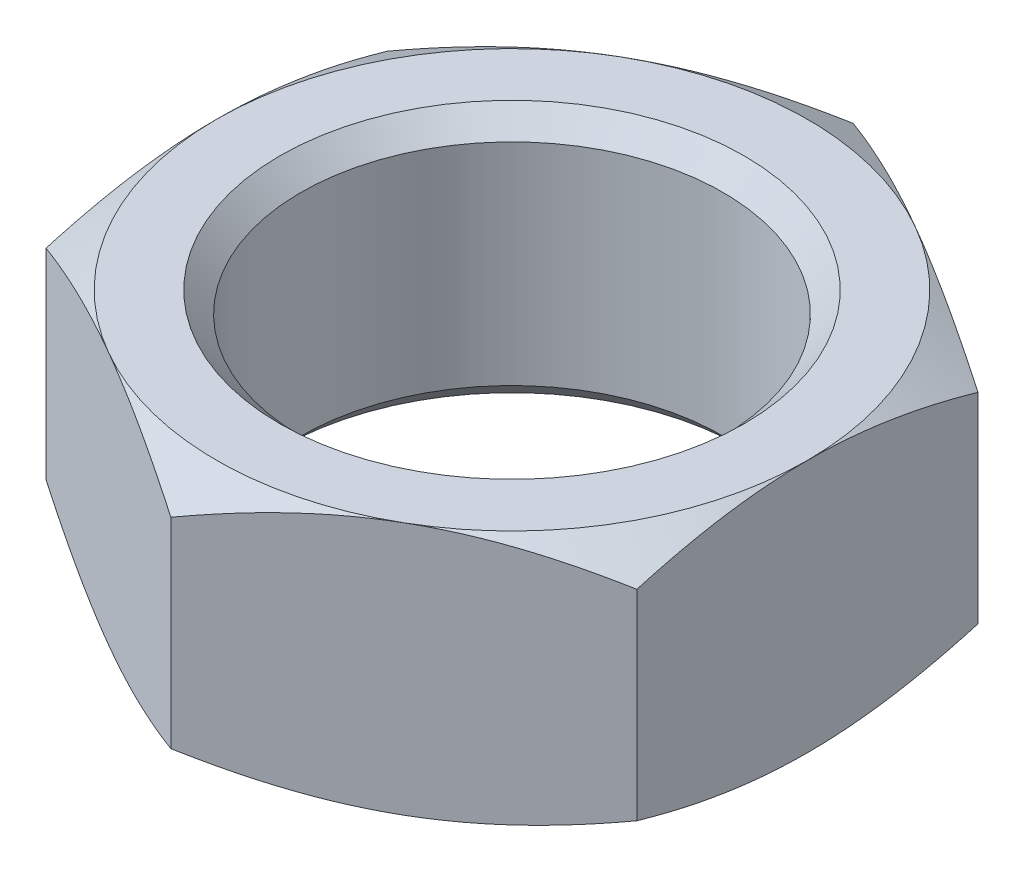
from build123d import *

# Parameters (mm, degrees)
BOSS_EXTRUDE1_DEPTH     = 6
SKETCH3_OUTSIDE_W       = 80.454
SKETCH3_OUTSIDE_H       = 84.786
SKETCH3_OUTSIDE_R       = 14
CUT_EXTRUDE1_DEPTH      = 12
CUT_EXTRUDE1_DRAFT      = -60
MIRROR1_COPY_1_SKETCH_W = 80.454
MIRROR1_COPY_1_SKETCH_H = 84.786
MIRROR1_COPY_1_SKETCH_R = 14
MIRROR1_COPY_1_DEPTH    = 12
MIRROR1_COPY_1_DRAFT    = -60
SKETCH4_R               = 10
CUT_EXTRUDE2_DEPTH      = 25.522098877
CHAMFER1_SIZE           = 1


with BuildPart() as part:
    # Sketch2 → Boss-Extrude1 (new, symmetric)
    with BuildSketch(Plane(origin=(0, 0, 0), x_dir=(1, 0, 0), z_dir=(0, 1, 0))):
        Polygon((0, 16.165807537), (-14, 8.082903769), (-14, -8.082903769), (0, -16.165807537), (14, -8.082903769), (14, 8.082903769), align=None)
    extrude(amount=BOSS_EXTRUDE1_DEPTH, both=True)


with BuildPart() as cut_extrude1_tool:
    # Sketch3 outside → Cut-Extrude1 (with draft: the straight prism first)
    with BuildSketch(Plane(origin=(0, 6, 0), x_dir=(1, 0, 0), z_dir=(0, 1, 0))):
        Rectangle(SKETCH3_OUTSIDE_W, SKETCH3_OUTSIDE_H)
        Circle(SKETCH3_OUTSIDE_R, mode=Mode.SUBTRACT)
    extrude(amount=-CUT_EXTRUDE1_DEPTH)
    # Cut-Extrude1: the draft: its side faces are tilted about the plane it starts from
    cut_extrude1_sides = [cut_extrude1_tool.faces().sort_by_distance(p)[0] for p in [
        (0, 0, 42.393),
        (40.227, 0, 0),
        (0, 0, -42.393),
        (-40.227, 0, 0),
        (-14, 0, 0),
    ]]
    draft(cut_extrude1_sides, Plane(origin=(0, 6, 0), x_dir=(1, 0, 0), z_dir=(0, 1, 0)), CUT_EXTRUDE1_DRAFT)


with BuildPart() as part_1:
    add(part.part)

    # Cut-Extrude1: cut by cut_extrude1_tool
    add(cut_extrude1_tool.part, mode=Mode.SUBTRACT)


with BuildPart() as mirror1_copy_1_tool:
    # Mirror1 copy 1 sketch → Mirror1 copy 1 (with draft: the straight prism first)
    with BuildSketch(Plane.XZ.offset(6)):
        Rectangle(MIRROR1_COPY_1_SKETCH_W, MIRROR1_COPY_1_SKETCH_H)
        Circle(MIRROR1_COPY_1_SKETCH_R, mode=Mode.SUBTRACT)
    extrude(amount=-MIRROR1_COPY_1_DEPTH)
    # Mirror1 copy 1: the draft: its side faces are tilted about the plane it starts from
    mirror1_copy_1_sides = [mirror1_copy_1_tool.faces().sort_by_distance(p)[0] for p in [
        (0, 0, 42.393),
        (40.227, 0, 0),
        (0, 0, -42.393),
        (-40.227, 0, 0),
        (-14, 0, 0),
    ]]
    draft(mirror1_copy_1_sides, Plane.XZ.offset(6), MIRROR1_COPY_1_DRAFT)


with BuildPart() as part_2:
    add(part_1.part)

    # Mirror1 copy 1: cut by mirror1_copy_1_tool
    add(mirror1_copy_1_tool.part, mode=Mode.SUBTRACT)

    # Sketch4 → Cut-Extrude2 (cut, through all)
    with BuildSketch(Plane.XZ.offset(6)):
        with Locations(Location((0, 0, 0), (0, 0, 270))):
            Circle(SKETCH4_R)
    extrude(amount=-CUT_EXTRUDE2_DEPTH, mode=Mode.SUBTRACT)

    # Chamfer1
    chamfer1_edges = [part_2.edges().sort_by_distance(p)[0] for p in [
        (0, 6, 10),
        (0, -6, 10),
    ]]
    chamfer(chamfer1_edges, length=CHAMFER1_SIZE)


solid = part_2.part
